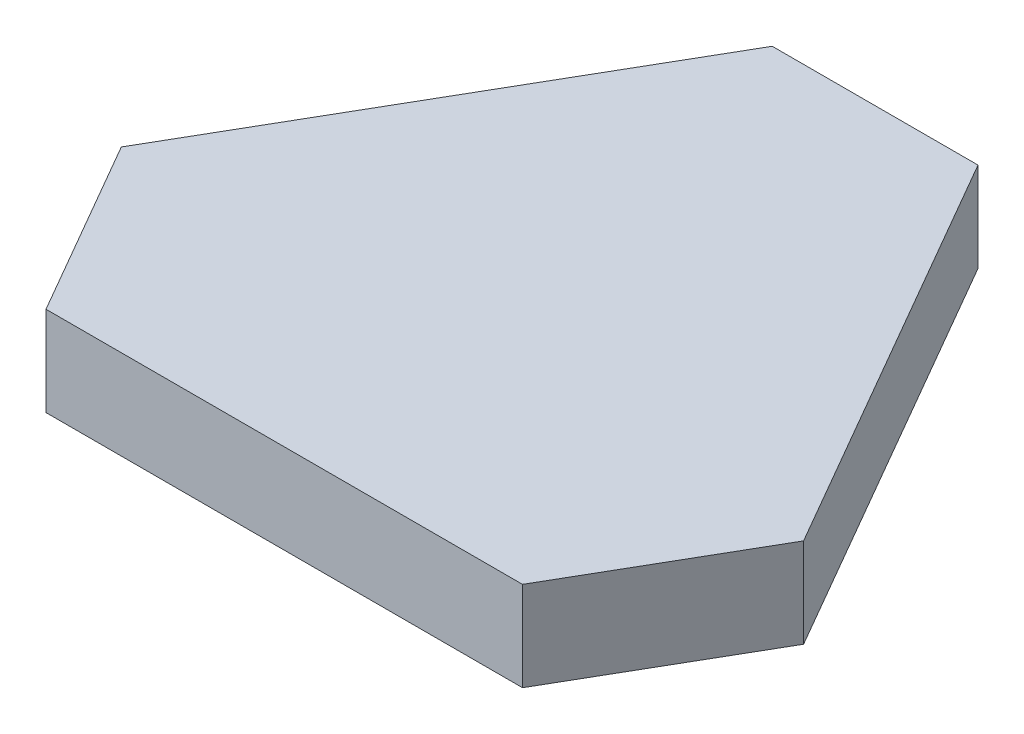
from build123d import *

# Parameters (mm, degrees)
EXTRUDE_1_DEPTH     = 5
FILLET_1_R          = 20
EXTRUDE_2_DEPTH     = 10
SKETCH_3_W          = 458.835277925
SKETCH_3_H          = 325.644744519
CUT_EXTRUDE_1_DEPTH = 10


with BuildPart() as part:
    # 草圖1 → 填料-伸長1 (new body)
    with BuildSketch(Plane(origin=(0, 0, 0), x_dir=(1, 0, 0), z_dir=(0, 1, 0))):
        Polygon((-90.122176988, 0), (90.122176988, 0), (165.122176988, 129.903810568), (75, 286), (-75, 286), (-165.122176988, 129.903810568), align=None)
    extrude(amount=EXTRUDE_1_DEPTH)

    # 圓角1
    fillet_1_edges = [part.edges().sort_by_distance(p)[0] for p in [
        (-165.122176988, 2.5, -129.903810568),
        (-75, 2.5, -286),
        (75, 2.5, -286),
        (165.122176988, 2.5, -129.903810568),
        (90.122176988, 2.5, 0),
        (-90.122176988, 2.5, 0),
    ]]
    fillet(fillet_1_edges, radius=FILLET_1_R)

    # 草圖2 → 填料-伸長2 (add)
    with BuildSketch(Plane(origin=(0, 5, 0), x_dir=(1, 0, 0), z_dir=(0, 1, 0))):
        Polygon((-26.613647377, 110), (26.613647377, 110), (38.105117767, 129.903810568), (11.491470389, 176), (-11.491470389, 176), (-38.105117767, 129.903810568), align=None)
    extrude(amount=EXTRUDE_2_DEPTH)

    # 草圖3 → 除料-伸長1 (cut)
    with BuildSketch(Plane(origin=(0, 5, 0), x_dir=(1, 0, 0), z_dir=(0, 1, 0))):
        with Locations((11.913832117, 140.556137002)):
            Rectangle(SKETCH_3_W, SKETCH_3_H)
    extrude(amount=-CUT_EXTRUDE_1_DEPTH, mode=Mode.SUBTRACT)


solid = part.part
